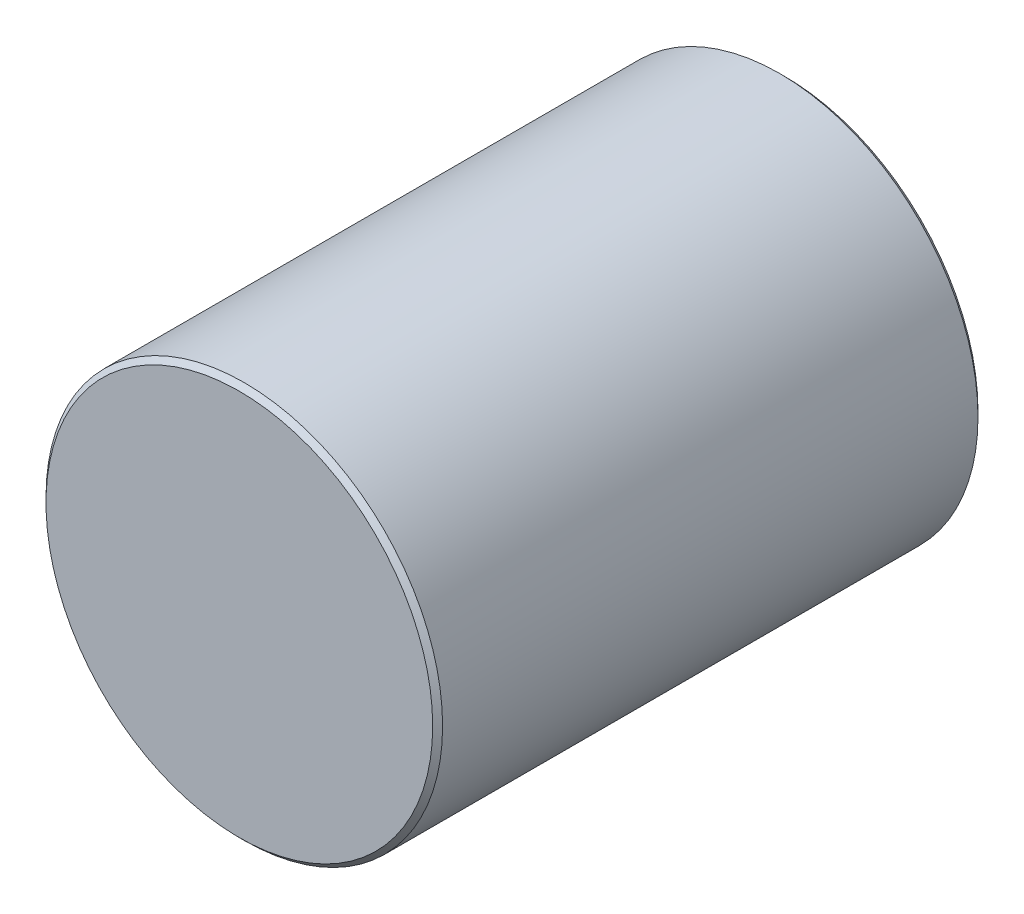
from build123d import *

# Parameters (mm, degrees)
IZIM1_R                     = 4
Y_KSEKLIK_EKSTR_ZYON1_DEPTH = 11
PAH1_SIZE                   = 0.1


with BuildPart() as part:
    # Çizim1 → Yükseklik-Ekstrüzyon1 (new body)
    with BuildSketch(Plane.XY):
        Circle(IZIM1_R)
    extrude(amount=Y_KSEKLIK_EKSTR_ZYON1_DEPTH)

    # Pah1
    pah1_edges = [part.edges().sort_by_distance(p)[0] for p in [
        (-4, 0, 0),
        (-4, 0, 11),
    ]]
    chamfer(pah1_edges, length=PAH1_SIZE)


solid = part.part
